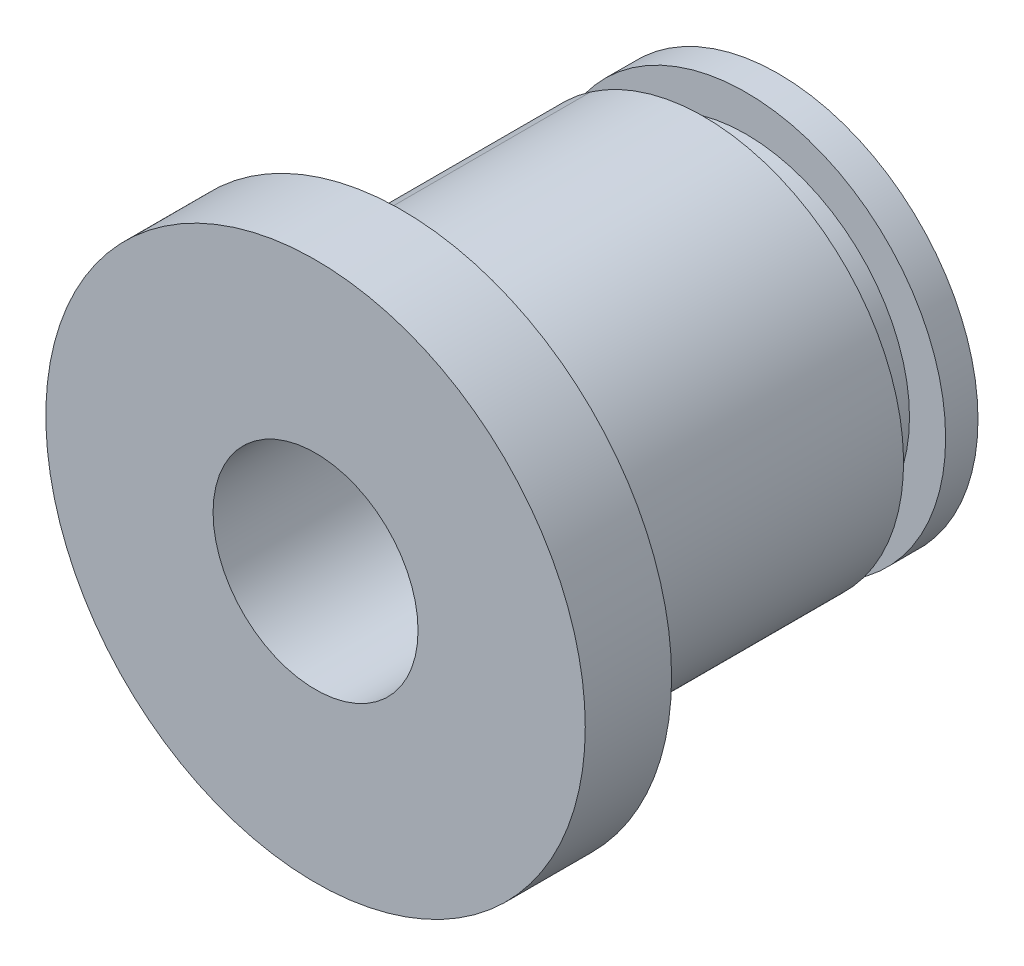
from build123d import *

# Parameters (mm, degrees)
SKETCH1_R           = 6.35
BOSS_EXTRUDE1_DEPTH = 2.032
SKETCH2_R           = 4.699
BOSS_EXTRUDE2_DEPTH = 8.8646
SKETCH4_W           = 0.9906
SKETCH4_H           = 0.8509
SKETCH8_R           = 2.413
CUT_EXTRUDE2_DEPTH  = 15.24


with BuildPart() as part:
    # Sketch1 → Boss-Extrude1 (new body)
    with BuildSketch(Plane.XY):
        Circle(SKETCH1_R)
    extrude(amount=BOSS_EXTRUDE1_DEPTH)

    # Sketch2 → Boss-Extrude2 (add)
    with BuildSketch(Plane(origin=(0, 0, 0), x_dir=(-1, 0, 0), z_dir=(0, 0, -1))):
        Circle(SKETCH2_R)
    extrude(amount=BOSS_EXTRUDE2_DEPTH)

    # Sketch4 → Cut-Revolve1 (revolve, cut)
    with BuildSketch(Plane(origin=(0, 0, 0), x_dir=(0, 0, -1), z_dir=(1, 0, 0)), mode=Mode.PRIVATE) as cut_revolve1_sk:
        with Locations((7.6073, 4.27355)):
            Rectangle(SKETCH4_W, SKETCH4_H)
    revolve(cut_revolve1_sk.sketch.rotate(Axis((0, 0, 6.549062663), (0, 0, -1)), 90), axis=Axis((0, 0, 6.549062663), (0, 0, -1)), mode=Mode.SUBTRACT)

    # Sketch8 → Cut-Extrude2 (cut)
    with BuildSketch(Plane.XY.offset(2.032)):
        Circle(SKETCH8_R)
    extrude(amount=-CUT_EXTRUDE2_DEPTH, mode=Mode.SUBTRACT)


solid = part.part
